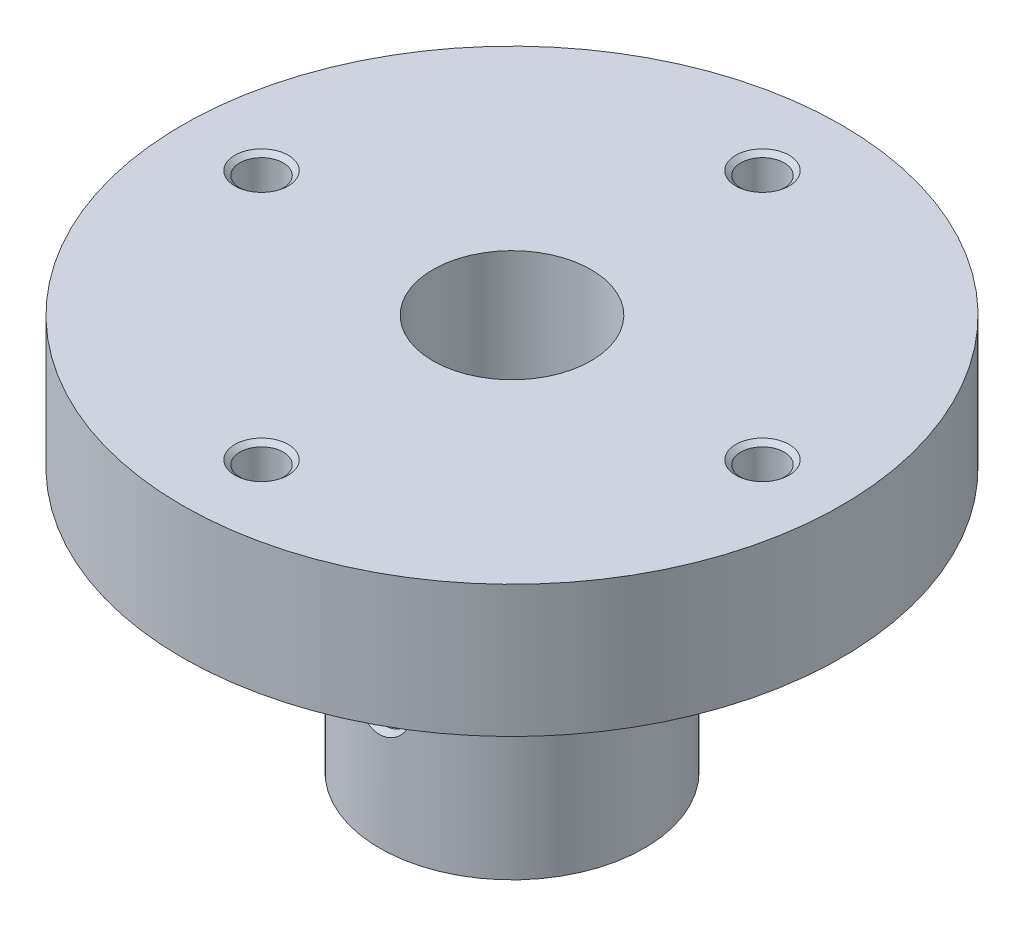
from build123d import *

# Parameters (mm, degrees)
SKETCH1_R                       = 25
BOSS_EXTRUDE1_DEPTH             = 10
SKETCH2_R                       = 10.037234393
BOSS_EXTRUDE2_DEPTH             = 20
SKETCH3_R                       = 6
CUT_EXTRUDE1_DEPTH              = 47.368092477
CIRPATTERN1_COUNT               = 4
M5X0_8_TAPPED_HOLE1_D           = 4.2
M5X0_8_TAPPED_HOLE1_DEPTH       = 11
M5X0_8_TAPPED_HOLE1_CSINK_D     = 5.05
M5X0_8_TAPPED_HOLE1_CSINK_ANGLE = 100
M5X0_8_TAPPED_HOLE1_TIP         = 1.2618073


with BuildPart() as part:
    # Sketch1 → Boss-Extrude1 (new body)
    with BuildSketch(Plane(origin=(0, 0, 0), x_dir=(1, 0, 0), z_dir=(0, 1, 0))):
        with Locations(Location((0, 0, 0), (0, 0, 270))):
            Circle(SKETCH1_R)
    extrude(amount=BOSS_EXTRUDE1_DEPTH)

    # Sketch2 → Boss-Extrude2 (add)
    with BuildSketch(Plane.XZ):
        with Locations(Location((0, 0, 0), (0, 0, 270))):
            Circle(SKETCH2_R)
    extrude(amount=BOSS_EXTRUDE2_DEPTH)

    # Sketch3 → Cut-Extrude1 (cut, through all)
    with BuildSketch(Plane(origin=(0, 10, 0), x_dir=(1, 0, 0), z_dir=(0, 1, 0))):
        with Locations(Location((0, 0, 0), (0, 0, 270))):
            Circle(SKETCH3_R)
    extrude(amount=-CUT_EXTRUDE1_DEPTH, mode=Mode.SUBTRACT)

    # Sketch5 → M4x0.7 Tapped Hole1 (revolve, cut)
    with BuildSketch(Plane(origin=(19, 10, 0), x_dir=(0, 0, 1), z_dir=(1, 0, 0))):
        Polygon((0, 0), (0, 9.991420021), (1.65, 9), (1.65, 0.314662362), (2.025, 0), align=None)
    m4x0_7_tapped_hole1 = revolve(axis=Axis((19, 16.35, 0), (0, -1, 0)), mode=Mode.SUBTRACT)

    # CirPattern1: M4x0.7 Tapped Hole1 ×4 about axis
    cirpattern1_axis = Axis((0, 0, 0), (0, 1, 0))
    for i in range(1, CIRPATTERN1_COUNT):
        add(m4x0_7_tapped_hole1.rotate(cirpattern1_axis, i * 360 / CIRPATTERN1_COUNT), mode=Mode.SUBTRACT)

    # M5x0.8 Tapped Hole1
    with Locations(Plane.XY.offset(10.037234393)):
        with Locations((0, -10)):
            CounterSinkHole(M5X0_8_TAPPED_HOLE1_D / 2, M5X0_8_TAPPED_HOLE1_CSINK_D / 2, depth=M5X0_8_TAPPED_HOLE1_DEPTH, counter_sink_angle=M5X0_8_TAPPED_HOLE1_CSINK_ANGLE)
            with Locations((0, 0, -(M5X0_8_TAPPED_HOLE1_DEPTH + M5X0_8_TAPPED_HOLE1_TIP / 2))):  # 118° drill point
                Cone(0, M5X0_8_TAPPED_HOLE1_D / 2, M5X0_8_TAPPED_HOLE1_TIP, mode=Mode.SUBTRACT)


solid = part.part
